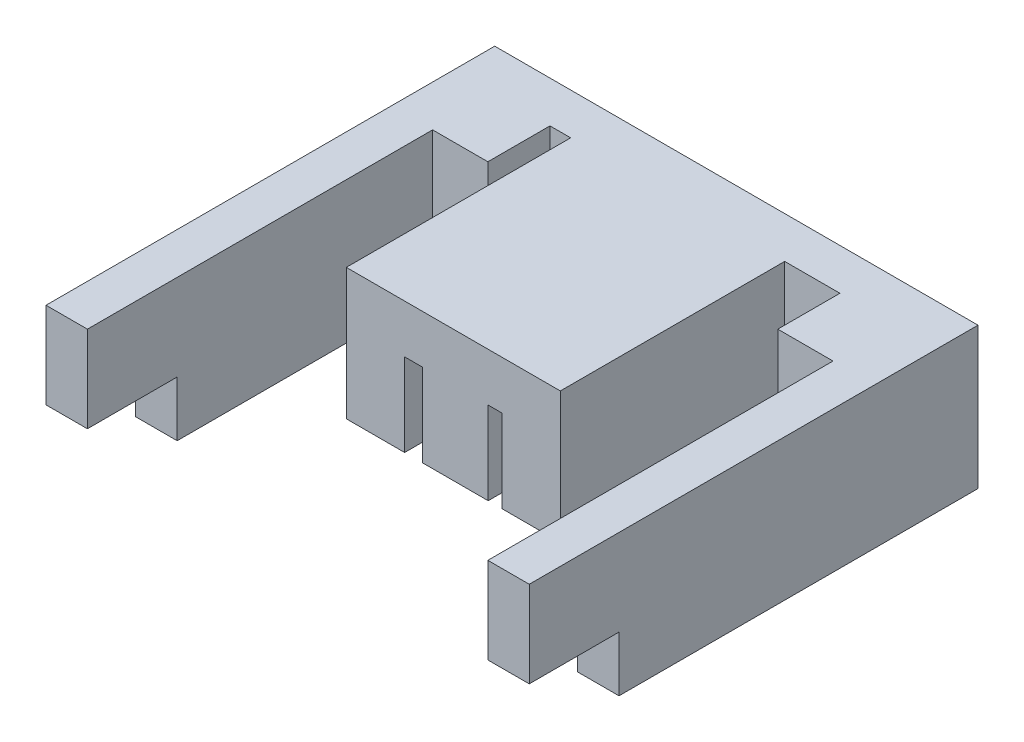
from build123d import *

# Parameters (mm, degrees)
BOSS_EXTRUDE1_DEPTH = 20.5
SKETCH2_W           = 6
SKETCH2_H           = 13
SKETCH2_W_2         = 25
SKETCH2_H_2         = 6
CUT_EXTRUDE1_DEPTH  = 8
SKETCH3_W           = 23
SKETCH3_H           = 23
BOSS_EXTRUDE2_DEPTH = 7
SKETCH4_W           = 31
SKETCH4_H           = 32.5
SKETCH4_W_2         = 23
SKETCH4_H_2         = 23
BOSS_EXTRUDE4_DEPTH = 19
CUT_EXTRUDE2_REACH  = 53.403
SKETCH5_W           = 2.6
SKETCH5_H           = 5.5
SKETCH5_H_2         = 4
SKETCH5_W_2         = 4
SKETCH5_H_3         = 15
SKETCH5_W_3         = 2
SKETCH6_R           = 1.5
CUT_EXTRUDE3_DEPTH  = 10
SKETCH7_W           = 8
SKETCH7_H           = 9
BOSS_EXTRUDE5_DEPTH = 20.5
SKETCH8_R           = 2
CUT_EXTRUDE4_DEPTH  = 10


with BuildPart() as part:
    # Sketch1 → Boss-Extrude1 (new body)
    with BuildSketch(Plane(origin=(0, 0, 0), x_dir=(1, 0, 0), z_dir=(0, 1, 0))):
        Polygon((29, -32.5), (35, -32.5), (35, 32.5), (-35, 32.5), (-35, -32.5), (-29, -32.5), (-29, 26.5), (29, 26.5), align=None)
    extrude(amount=BOSS_EXTRUDE1_DEPTH)

    # Sketch2 → Cut-Extrude1 (cut)
    with BuildSketch(Plane.XZ):
        with Locations((32, 26)):
            Rectangle(SKETCH2_W, SKETCH2_H)
        with Locations((0, -29.5)):
            Rectangle(SKETCH2_W_2, SKETCH2_H_2)
        with Locations((-32, 26)):
            Rectangle(SKETCH2_W, SKETCH2_H)
    extrude(amount=-CUT_EXTRUDE1_DEPTH, mode=Mode.SUBTRACT)



with BuildPart() as body_2:
    # Sketch3 → Boss-Extrude2 (new body)
    with BuildSketch(Plane(origin=(0, 20.5, 0), x_dir=(1, 0, 0), z_dir=(0, 1, 0))):
        with Locations((-2.5, 9.5)):
            Rectangle(SKETCH3_W, SKETCH3_H)
    extrude(amount=-BOSS_EXTRUDE2_DEPTH)


with BuildPart() as part_1:
    add(part.part)

    add(body_2.part)  # Boss-Extrude4 merges body 2
    # Sketch4 → Boss-Extrude4 (add)
    with BuildSketch(Plane(origin=(0, 20.5, 0), x_dir=(1, 0, 0), z_dir=(0, 1, 0))):
        with Locations((-2.5, 10.25)):
            Rectangle(SKETCH4_W, SKETCH4_H)
        with Locations((-2.5, 9.5)):
            Rectangle(SKETCH4_W_2, SKETCH4_H_2, mode=Mode.SUBTRACT)
    extrude(amount=-BOSS_EXTRUDE4_DEPTH)

    # Cut-Extrude2: up to this face of the body (flat: up to its plane)
    cut_extrude2_end = Plane(part_1.part.faces().sort_by_distance((-2.5, 13.5, -9.5))[0])
    # Sketch5 → Cut-Extrude2 (cut, up to the picked face)
    with BuildSketch(Plane.XZ.offset(-1.5), mode=Mode.PRIVATE) as cut_extrude2_sk1:
        with Locations((-8.25, -23.75)):
            Rectangle(SKETCH5_W, SKETCH5_H)
    cut_extrude2_tool1 = split(extrude(cut_extrude2_sk1.sketch, amount=-CUT_EXTRUDE2_REACH, mode=Mode.PRIVATE), bisect_by=cut_extrude2_end, keep=Keep.BOTH, mode=Mode.PRIVATE)
    # Sketch5 → Cut-Extrude2 (cut, up to the picked face)
    with BuildSketch(Plane.XZ.offset(-1.5), mode=Mode.PRIVATE) as cut_extrude2_sk2:
        with Locations((-8.25, 4)):
            Rectangle(SKETCH5_W, SKETCH5_H_2)
    cut_extrude2_tool2 = split(extrude(cut_extrude2_sk2.sketch, amount=-CUT_EXTRUDE2_REACH, mode=Mode.PRIVATE), bisect_by=cut_extrude2_end, keep=Keep.BOTH, mode=Mode.PRIVATE)
    # Sketch5 → Cut-Extrude2 (cut, up to the picked face)
    with BuildSketch(Plane.XZ.offset(-1.5), mode=Mode.PRIVATE) as cut_extrude2_sk3:
        with Locations((-16, -5.5)):
            Rectangle(SKETCH5_W_2, SKETCH5_H_3)
    cut_extrude2_tool3 = split(extrude(cut_extrude2_sk3.sketch, amount=-CUT_EXTRUDE2_REACH, mode=Mode.PRIVATE), bisect_by=cut_extrude2_end, keep=Keep.BOTH, mode=Mode.PRIVATE)
    # Sketch5 → Cut-Extrude2 (cut, up to the picked face)
    with BuildSketch(Plane.XZ.offset(-1.5), mode=Mode.PRIVATE) as cut_extrude2_sk4:
        with Locations((3.55, 4)):
            Rectangle(SKETCH5_W_3, SKETCH5_H_2)
    cut_extrude2_tool4 = split(extrude(cut_extrude2_sk4.sketch, amount=-CUT_EXTRUDE2_REACH, mode=Mode.PRIVATE), bisect_by=cut_extrude2_end, keep=Keep.BOTH, mode=Mode.PRIVATE)
    add(cut_extrude2_tool1.solids().sort_by(Axis((-8.25, 1.5, -23.75), (0, 1, 0)))[0], mode=Mode.SUBTRACT)
    add(cut_extrude2_tool2.solids().sort_by(Axis((-8.25, 1.5, 4), (0, 1, 0)))[0], mode=Mode.SUBTRACT)
    add(cut_extrude2_tool3.solids().sort_by(Axis((-16, 1.5, -5.5), (0, 1, 0)))[0], mode=Mode.SUBTRACT)
    add(cut_extrude2_tool4.solids().sort_by(Axis((3.55, 1.5, 4), (0, 1, 0)))[0], mode=Mode.SUBTRACT)

    # Sketch6 → Cut-Extrude3 (cut)
    with BuildSketch(Plane.XZ):
        with Locations(Location((-32, 14.5, 0), (0, 0, 270))):
            Circle(SKETCH6_R)
        with Locations(Location((-32, -21.5, 0), (0, 0, 270))):
            Circle(SKETCH6_R)
    cut_extrude3 = extrude(amount=-CUT_EXTRUDE3_DEPTH, mode=Mode.SUBTRACT)

    # Mirror1: Cut-Extrude3 across plane
    add(cut_extrude3.mirror(Plane(origin=(0, 0, 0), x_dir=(0, 0, 1), z_dir=(1, 0, 0))), mode=Mode.SUBTRACT)

    # Sketch7 → Boss-Extrude5 (add)
    with BuildSketch(Plane(origin=(0, 20.5, 0), x_dir=(1, 0, 0), z_dir=(0, 1, 0))):
        with Locations((25, 22)):
            Rectangle(SKETCH7_W, SKETCH7_H)
        with Locations((-25, 22)):
            Rectangle(SKETCH7_W, SKETCH7_H)
    extrude(amount=-BOSS_EXTRUDE5_DEPTH)

    # Sketch8 → Cut-Extrude4 (cut)
    with BuildSketch(Plane(origin=(0, 0, -32.5), x_dir=(-1, 0, 0), z_dir=(0, 0, -1))):
        with Locations((-25, 11)):
            Circle(SKETCH8_R)
        with Locations((25, 11)):
            Circle(SKETCH8_R)
    extrude(amount=-CUT_EXTRUDE4_DEPTH, mode=Mode.SUBTRACT)


solid = part_1.part
